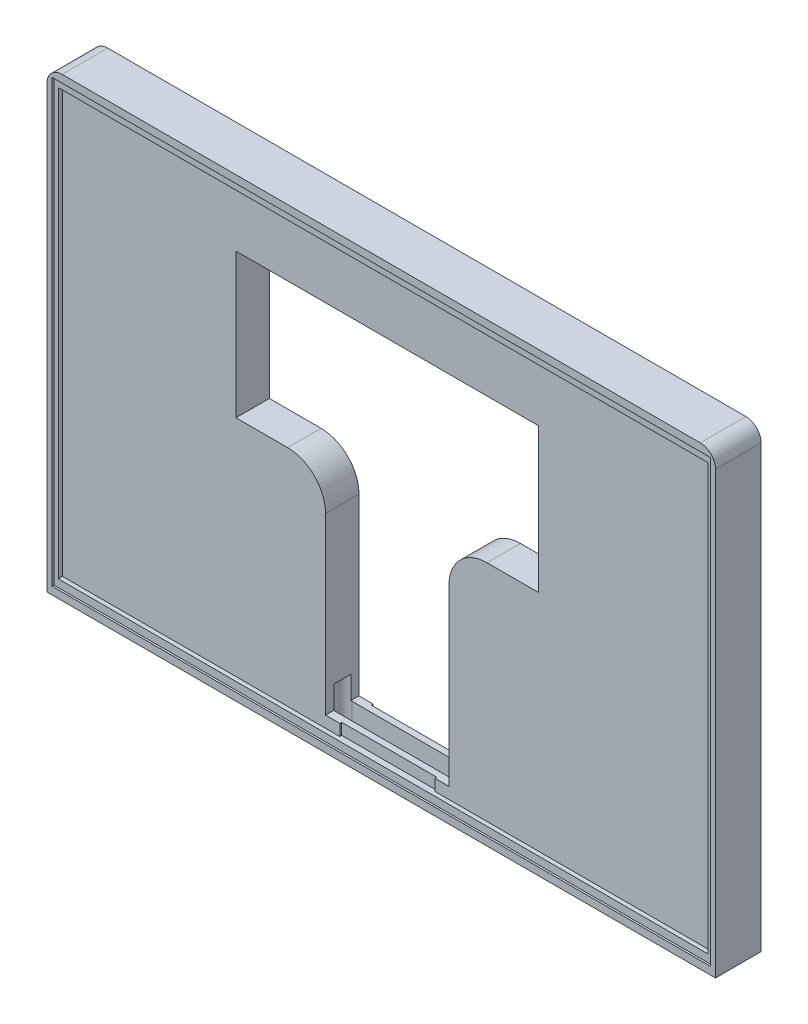
from build123d import *

# Parameters (mm, degrees)
SKETCH_1_W           = 176
SKETCH_1_H           = 120
EXTRUDE_1_DEPTH      = 12
SKETCH_2_W           = 171
SKETCH_2_H           = 112
CUT_EXTRUDE_1_DEPTH  = 1.6
SKETCH_3_W           = 171
SKETCH_3_H           = 112
CUT_EXTRUDE_2_DEPTH  = 1.6
SKETCH_5_W           = 173.4
SKETCH_5_H           = 116
CUT_EXTRUDE_3_DEPTH  = 0.5
SKETCH_6_W           = 173.4
SKETCH_6_H           = 116
CUT_EXTRUDE_4_DEPTH  = 0.5
SKETCH_7_W           = 32.5
SKETCH_7_H           = 56
CUT_EXTRUDE_5_DEPTH  = 108.014765336
SKETCH_8_W           = 25
SKETCH_8_H           = 5
CUT_EXTRUDE_6_DEPTH  = 0.5
SKETCH_9_W           = 25
SKETCH_9_H           = 5
CUT_EXTRUDE_7_DEPTH  = 0.5
FILLET_1_R           = 4
FILLET_2_R           = 4
SKETCH_28_R          = 2.75
CUT_EXTRUDE_16_DEPTH = 5.5
CUT_EXTRUDE_17_DEPTH = 13
SKETCH_31_W          = 79.660251382
SKETCH_31_H          = 38
CUT_EXTRUDE_18_DEPTH = 108.014765336
FILLET_3_R           = 10
FILLET_4_R           = 10


with BuildPart() as part:
    # 草图1 → 凸台-拉伸1 (new body)
    with BuildSketch(Plane.XY):
        Rectangle(SKETCH_1_W, SKETCH_1_H)
    extrude(amount=EXTRUDE_1_DEPTH)

    # 草图2 → 切除-拉伸1 (cut)
    with BuildSketch(Plane.XY.offset(12)):
        Rectangle(SKETCH_2_W, SKETCH_2_H)
    extrude(amount=-CUT_EXTRUDE_1_DEPTH, mode=Mode.SUBTRACT)

    # 草图3 → 切除-拉伸2 (cut)
    with BuildSketch(Plane(origin=(0, 0, 0), x_dir=(-1, 0, 0), z_dir=(0, 0, -1))):
        Rectangle(SKETCH_3_W, SKETCH_3_H)
    extrude(amount=-CUT_EXTRUDE_2_DEPTH, mode=Mode.SUBTRACT)

    # 草图5 → 切除-拉伸3 (cut)
    with BuildSketch(Plane(origin=(0, 0, 0), x_dir=(-1, 0, 0), z_dir=(0, 0, -1))):
        Rectangle(SKETCH_5_W, SKETCH_5_H)
    extrude(amount=-CUT_EXTRUDE_3_DEPTH, mode=Mode.SUBTRACT)

    # 草图6 → 切除-拉伸4 (cut)
    with BuildSketch(Plane.XY.offset(12)):
        Rectangle(SKETCH_6_W, SKETCH_6_H)
    extrude(amount=-CUT_EXTRUDE_4_DEPTH, mode=Mode.SUBTRACT)

    # 草图7 → 切除-拉伸5 (cut, through all)
    with BuildSketch(Plane(origin=(0, 0, 1.6), x_dir=(-1, 0, 0), z_dir=(0, 0, -1))):
        with Locations((0, -25)):
            Rectangle(SKETCH_7_W, SKETCH_7_H)
    extrude(amount=-CUT_EXTRUDE_5_DEPTH, mode=Mode.SUBTRACT)

    # 草图8 → 切除-拉伸6 (cut)
    with BuildSketch(Plane(origin=(0, 0, 1.6), x_dir=(-1, 0, 0), z_dir=(0, 0, -1))):
        with Locations((0, -53.5)):
            Rectangle(SKETCH_8_W, SKETCH_8_H)
    extrude(amount=-CUT_EXTRUDE_6_DEPTH, mode=Mode.SUBTRACT)

    # 草图9 → 切除-拉伸7 (cut)
    with BuildSketch(Plane.XY.offset(10.4)):
        with Locations((0, -53.5)):
            Rectangle(SKETCH_9_W, SKETCH_9_H)
    extrude(amount=-CUT_EXTRUDE_7_DEPTH, mode=Mode.SUBTRACT)

    # 圆角1
    fillet_1_edges = [part.edges().sort_by_distance(p)[0] for p in [
        (-88, 60, 6),
    ]]
    fillet(fillet_1_edges, radius=FILLET_1_R)

    # 圆角2
    fillet_2_edges = [part.edges().sort_by_distance(p)[0] for p in [
        (88, 60, 6),
    ]]
    fillet(fillet_2_edges, radius=FILLET_2_R)

    # 草图28 → 切除-拉伸16 (cut)
    with BuildSketch(Plane(origin=(0, -60, 0), x_dir=(-1, 0, 0), z_dir=(0, -1, 0))):
        with Locations(Location((-72, -6, 0), (0, 0, 180))):
            Circle(SKETCH_28_R)
        with Locations(Location((-38, -6, 0), (0, 0, 180))):
            Circle(SKETCH_28_R)
        with Locations(Location((38, -6, 0), (0, 0, 180))):
            Circle(SKETCH_28_R)
        with Locations(Location((72, -6, 0), (0, 0, 180))):
            Circle(SKETCH_28_R)
    extrude(amount=-CUT_EXTRUDE_16_DEPTH, mode=Mode.SUBTRACT)

    # 草图29 → 切除-拉伸17 (cut)
    with BuildSketch(Plane.XZ.offset(60)):
        with BuildLine():
            Line((-16, 8.25), (16, 8.25))
            ThreePointArc((16, 8.25), (18.25, 6), (16, 3.75))
            Line((16, 3.75), (-16, 3.75))
            ThreePointArc((-16, 3.75), (-18.25, 6), (-16, 8.25))
        make_face()
    extrude(amount=-CUT_EXTRUDE_17_DEPTH, mode=Mode.SUBTRACT)

    # 草图31 → 切除-拉伸18 (cut, through all)
    with BuildSketch(Plane(origin=(0, 0, 1.6), x_dir=(-1, 0, 0), z_dir=(0, 0, -1))):
        with Locations((0, 22)):
            Rectangle(SKETCH_31_W, SKETCH_31_H)
    extrude(amount=-CUT_EXTRUDE_18_DEPTH, mode=Mode.SUBTRACT)

    # 圆角3
    fillet_3_edges = [part.edges().sort_by_distance(p)[0] for p in [
        (-16.25, 3, 6),
    ]]
    fillet(fillet_3_edges, radius=FILLET_3_R)

    # 圆角4
    fillet_4_edges = [part.edges().sort_by_distance(p)[0] for p in [
        (16.25, 3, 6),
    ]]
    fillet(fillet_4_edges, radius=FILLET_4_R)


solid = part.part
